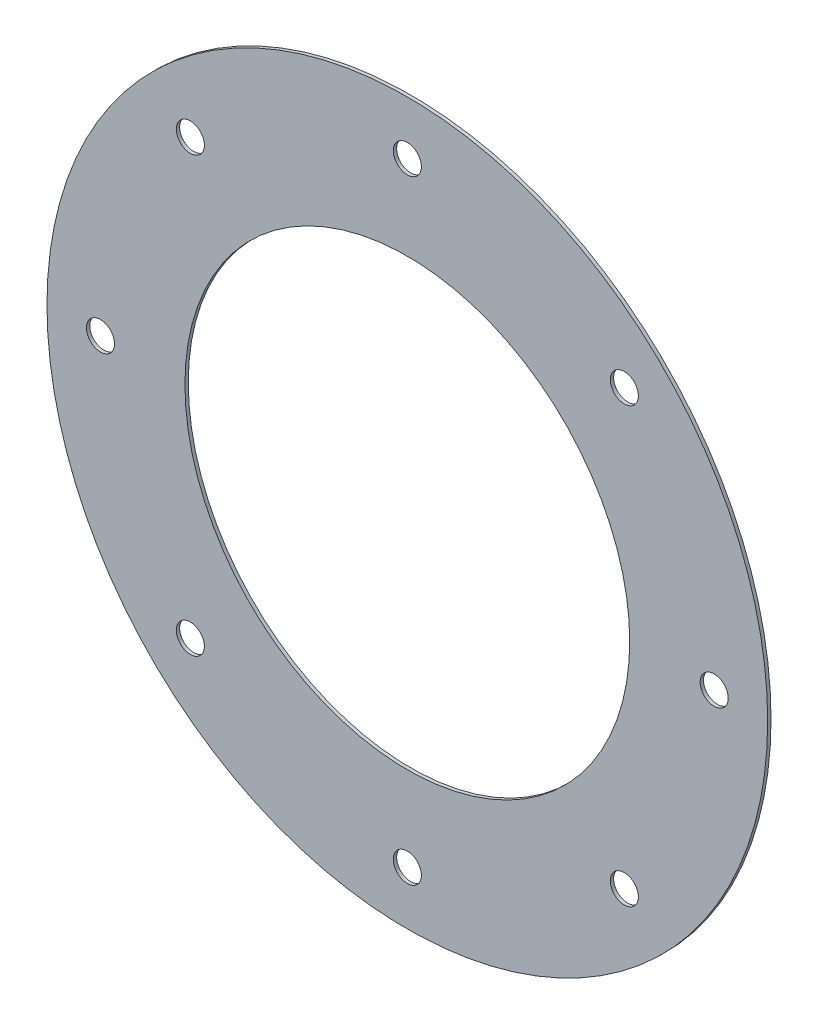
from build123d import *

# Parameters (mm, degrees)
SKETCH1_R           = 53.875
SKETCH1_R_2         = 33.25
SKETCH1_R_3         = 2.1
BOSS_EXTRUDE1_DEPTH = 0.5


with BuildPart() as part:
    # Sketch1 → Boss-Extrude1 (new body)
    with BuildSketch(Plane.XY):
        Circle(SKETCH1_R)
        Circle(SKETCH1_R_2, mode=Mode.SUBTRACT)
        with Locations((0, 45.875)):
            Circle(SKETCH1_R_3, mode=Mode.SUBTRACT)
        with Locations((32.438523587, 32.438523587)):
            Circle(SKETCH1_R_3, mode=Mode.SUBTRACT)
        with Locations((45.875, 0)):
            Circle(SKETCH1_R_3, mode=Mode.SUBTRACT)
        with Locations((32.438523587, -32.438523587)):
            Circle(SKETCH1_R_3, mode=Mode.SUBTRACT)
        with Locations((0, -45.875)):
            Circle(SKETCH1_R_3, mode=Mode.SUBTRACT)
        with Locations((-32.438523587, -32.438523587)):
            Circle(SKETCH1_R_3, mode=Mode.SUBTRACT)
        with Locations((-45.875, 0)):
            Circle(SKETCH1_R_3, mode=Mode.SUBTRACT)
        with Locations((-32.438523587, 32.438523587)):
            Circle(SKETCH1_R_3, mode=Mode.SUBTRACT)
    extrude(amount=BOSS_EXTRUDE1_DEPTH)


solid = part.part
